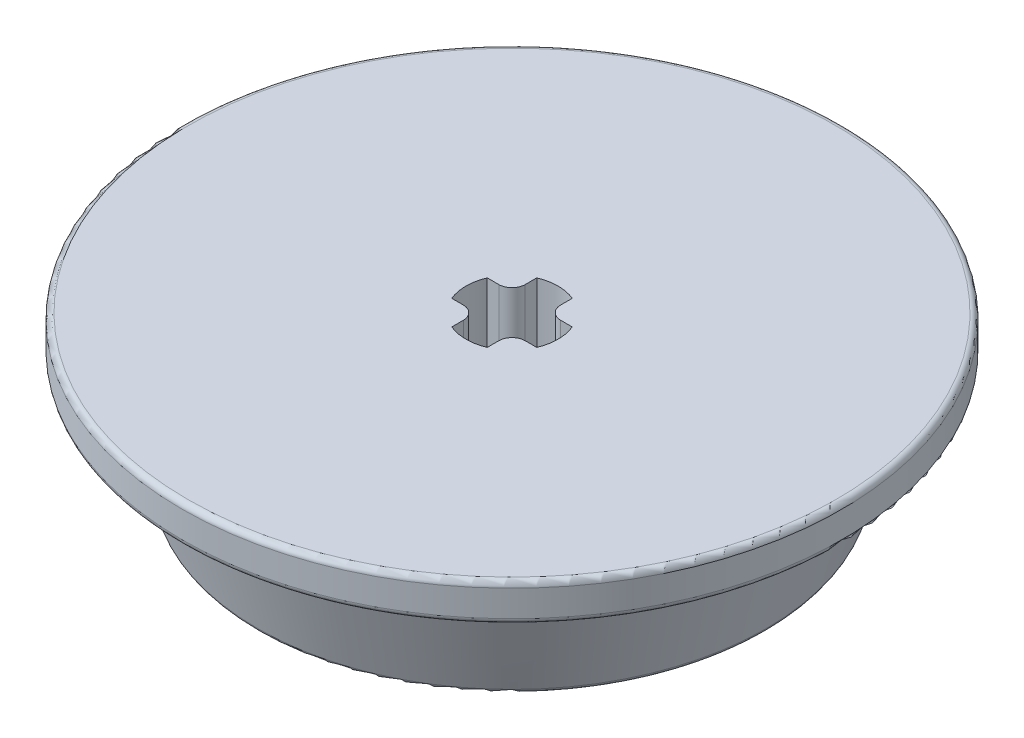
from build123d import *

# Parameters (mm, degrees)
CUT_EXTRUDE1_DEPTH = 26.956426849
FILLET1_R          = 0.7
FILLET2_R          = 0.3


with BuildPart() as part:
    # Sketch2 → Revolve1 (revolve)
    with BuildSketch(Plane.XY, mode=Mode.PRIVATE) as revolve1_sk:
        Polygon((0, 0), (17.460470996, 0), (17.460470996, -2), (15, -2), (13.392304845, -8), (0, -8), align=None)
    revolve(revolve1_sk.sketch.rotate(Axis((0, 0, 0), (0, 1, 0)), 90), axis=Axis((0, 0, 0), (0, 1, 0)))

    # Sketch1 → Cut-Extrude1 (cut, through all)
    with BuildSketch(Plane(origin=(0, 0, 0), x_dir=(1, 0, 0), z_dir=(0, 1, 0))):
        with BuildLine():
            Line((-0.94, 0.94), (-2.25166605, 0.94))
            ThreePointArc((-2.25166605, 0.94), (-2.44, 0), (-2.25166605, -0.94))
            Line((-2.25166605, -0.94), (-0.94, -0.94))
            Line((-0.94, -0.94), (-0.94, -2.25166605))
            ThreePointArc((-0.94, -2.25166605), (0, -2.44), (0.94, -2.25166605))
            Line((0.94, -2.25166605), (0.94, -0.94))
            Line((0.94, -0.94), (2.25166605, -0.94))
            ThreePointArc((2.25166605, -0.94), (2.44, 0), (2.25166605, 0.94))
            Line((2.25166605, 0.94), (0.94, 0.94))
            Line((0.94, 0.94), (0.94, 2.25166605))
            ThreePointArc((0.94, 2.25166605), (0, 2.44), (-0.94, 2.25166605))
            Line((-0.94, 2.25166605), (-0.94, 0.94))
        make_face()
    extrude(amount=-CUT_EXTRUDE1_DEPTH, mode=Mode.SUBTRACT)

    # Fillet1
    fillet1_edges = [part.edges().sort_by_distance(p)[0] for p in [
        (-0.94, -4, -0.94),
        (0.94, -4, -0.94),
        (0.94, -4, 0.94),
        (-0.94, -4, 0.94),
    ]]
    fillet(fillet1_edges, radius=FILLET1_R)

    # Fillet2
    fillet2_edges = [part.edges().sort_by_distance(p)[0] for p in [
        (0, -8, 13.392304845),
        (0, -2, 15),
        (0, -2, 17.460470996),
        (0, 0, 17.460470996),
    ]]
    fillet(fillet2_edges, radius=FILLET2_R)


solid = part.part
